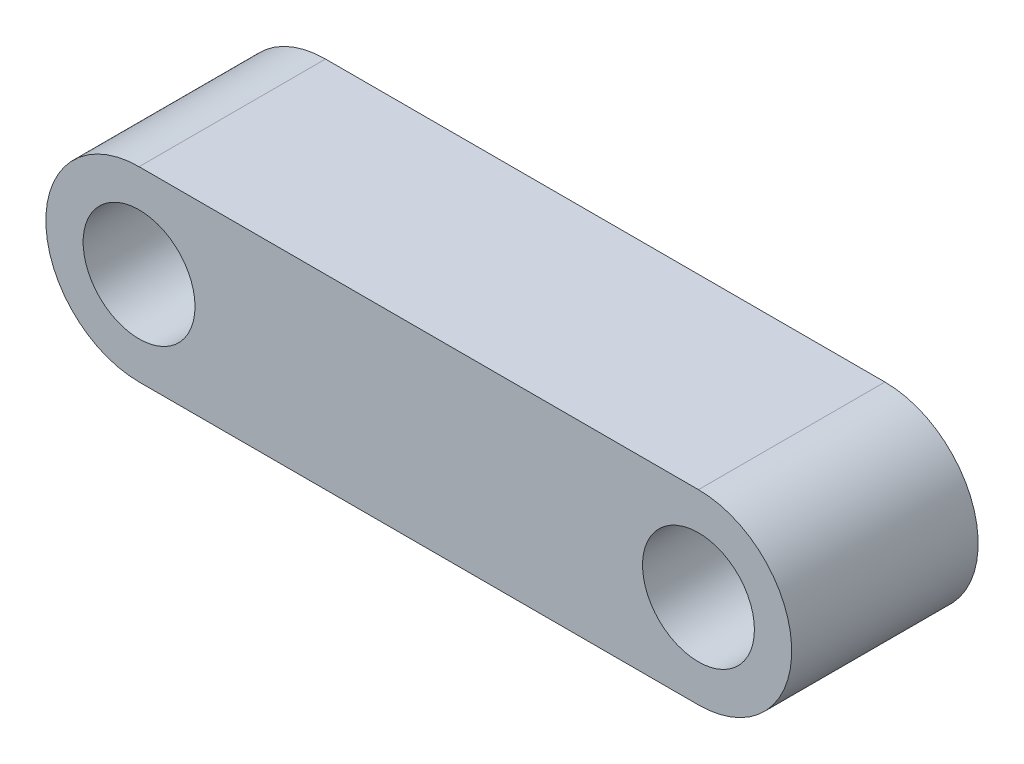
from build123d import *

# Parameters (mm, degrees)
BOSS_EXTRUDE1_DEPTH = 20
SKETCH2_R           = 6
CUT_EXTRUDE1_DEPTH  = 46.82575695


with BuildPart() as part:
    # Sketch1 → Boss-Extrude1 (new body)
    with BuildSketch(Plane.XY):
        with BuildLine():
            Line((30, -10), (-30, -10))
            ThreePointArc((-30, -10), (-40, 0), (-30, 10))
            Line((-30, 10), (30, 10))
            ThreePointArc((30, 10), (40, 0), (30, -10))
        make_face()
    extrude(amount=BOSS_EXTRUDE1_DEPTH)

    # Sketch2 → Cut-Extrude1 (cut, through all)
    with BuildSketch(Plane.XY.offset(20)):
        with Locations((-30, 0)):
            Circle(SKETCH2_R)
        with Locations((30, 0)):
            Circle(SKETCH2_R)
    extrude(amount=-CUT_EXTRUDE1_DEPTH, mode=Mode.SUBTRACT)


solid = part.part
